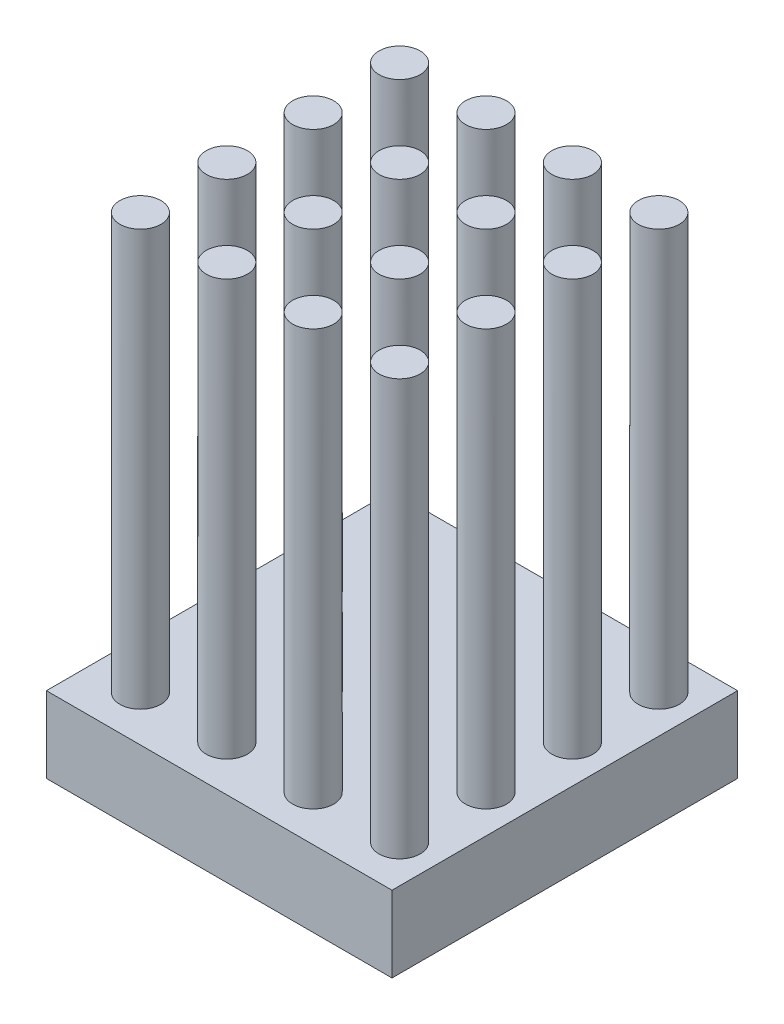
from build123d import *

# Parameters (mm, degrees)
SKETCH1_W            = 10
SKETCH1_H            = 10
BOSS_EXTRUDE1_DEPTH  = 2.2
SKETCH2_R            = 0.595
BOSS_EXTRUDE2_DEPTH  = 12.03
LPATTERN1_COUNT      = 4
LPATTERN1_PITCH      = 2.5
LPATTERN1_COUNT_DIR2 = 4
LPATTERN1_PITCH_DIR2 = 2.5


with BuildPart() as part:
    # Sketch1 → Boss-Extrude1 (new body)
    with BuildSketch(Plane(origin=(0, 0, 0), x_dir=(1, 0, 0), z_dir=(0, 1, 0))):
        Rectangle(SKETCH1_W, SKETCH1_H)
    extrude(amount=BOSS_EXTRUDE1_DEPTH)

    # Sketch2 → Boss-Extrude2 (add)
    with BuildSketch(Plane(origin=(0, 2.2, 0), x_dir=(1, 0, 0), z_dir=(0, 1, 0))):
        with Locations(Location((-3.595, -3.685, 0), (0, 0, 90))):
            Circle(SKETCH2_R)
    boss_extrude2 = extrude(amount=BOSS_EXTRUDE2_DEPTH)

    # LPattern1: Boss-Extrude2 4 × 4
    with Locations(*[(i * LPATTERN1_PITCH, 0, -j * LPATTERN1_PITCH_DIR2) for i in range(LPATTERN1_COUNT) for j in range(LPATTERN1_COUNT_DIR2) if (i, j) != (0, 0)]):
        add(boss_extrude2)


solid = part.part
